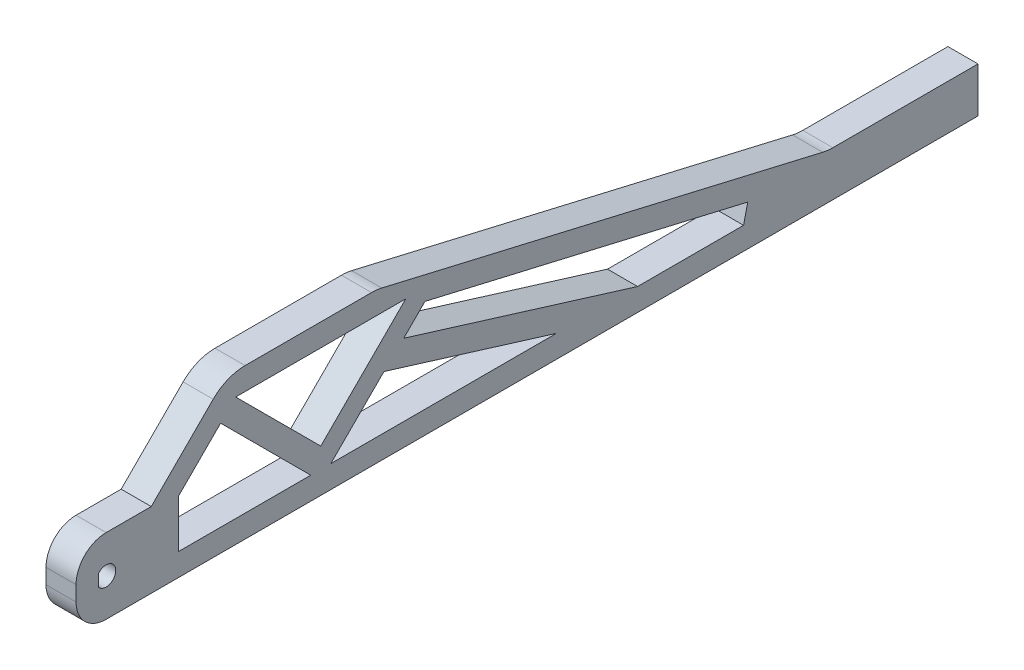
from build123d import *

# Parameters (mm, degrees)
BOSS_EXTRUDE1_DEPTH = 10
CUT_EXTRUDE2_DEPTH  = 305.302481094
FILLET1_R           = 10
FILLET2_R           = 15


with BuildPart() as part:
    # Sketch1 → Boss-Extrude1 (new body)
    with BuildSketch(Plane(origin=(0, 0, 0), x_dir=(0, 0, -1), z_dir=(1, 0, 0))):
        Polygon((0, 0), (300, 0), (300, 15), (250, 15), (100, 50), (50, 50), (25, 25), (0, 25), align=None)
    extrude(amount=-BOSS_EXTRUDE1_DEPTH)

    # Sketch2 → Cut-Extrude2 (cut, through all)
    with BuildSketch(Plane(origin=(0, 0, 0), x_dir=(0, 0, -1), z_dir=(1, 0, 0))):
        Polygon((53.106601718, 42.5), (109.675144213, 42.5), (81.390872965, 14.215728753), align=None)
        Polygon((34.106601718, 23.5), (34.106601718, 7.5), (78.051863034, 7.5), (48.079232376, 37.472630658), align=None)
        Polygon((102.407552426, 25.17766953), (84.729882897, 7.5), (159.744277132, 7.5), align=None)
        Polygon((116.052511988, 38.552952969), (223.422310427, 13.5), (222.022310427, 7.5), (186.765608253, 7.5), (108.981444176, 31.481885157), align=None)
        with BuildLine():
            Line((7.46, 14.446381258), (7.46, 10.553618742))
            ThreePointArc((7.46, 10.553618742), (13.2, 12.5), (7.46, 14.446381258))
        make_face()
    extrude(amount=-CUT_EXTRUDE2_DEPTH, mode=Mode.SUBTRACT)

    # Fillet1
    fillet1_edges = [part.edges().sort_by_distance(p)[0] for p in [
        (-5, 25, 0),
        (-5, 0, 0),
    ]]
    fillet(fillet1_edges, radius=FILLET1_R)

    # Fillet2
    fillet2_edges = [part.edges().sort_by_distance(p)[0] for p in [
        (-5, 50, -50),
        (-5, 50, -100),
        (-5, 15, -250),
    ]]
    fillet(fillet2_edges, radius=FILLET2_R)


solid = part.part
